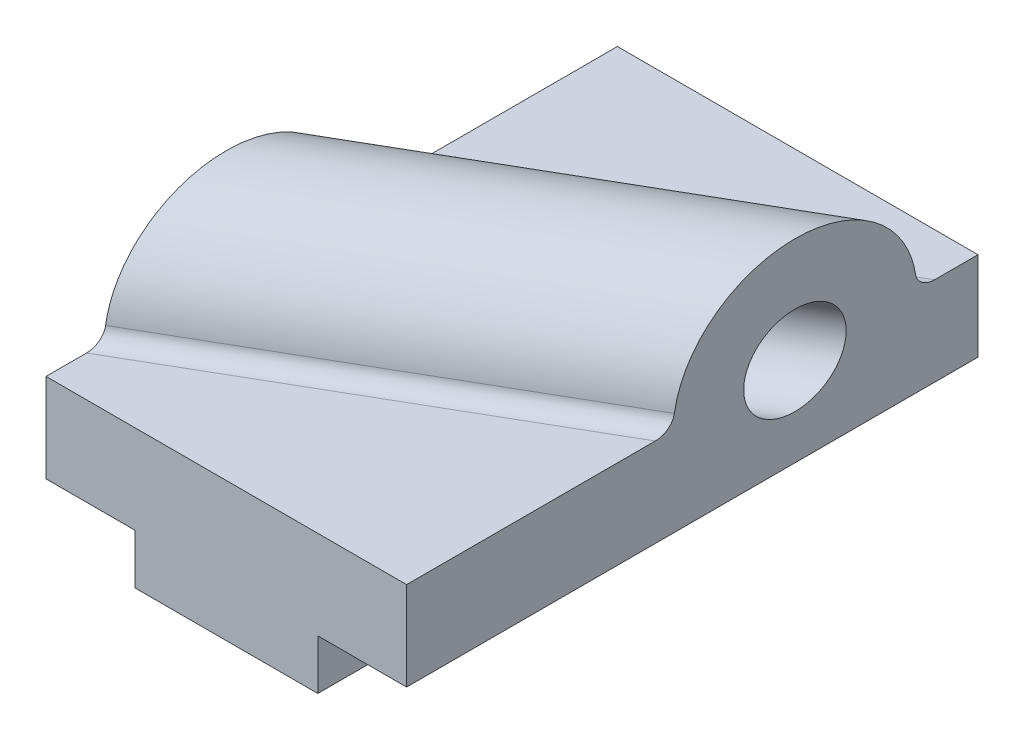
from build123d import *

# Parameters (mm, degrees)
BOSS_EXTRUDE1_DEPTH             = 103
BOSS_EXTRUDE4_REACH             = 109.274
BOSS_EXTRUDE4_DIRECTION_2_REACH = 109.274
CUT_EXTRUDE1_DEPTH              = 111.752171083
CUT_EXTRUDE1_DEPTH_BACK         = 111.752171083
SKETCH4_R                       = 8
FILLET1_R                       = 3


with BuildPart() as part:
    # Sketch2 → Boss-Extrude1 (new body)
    with BuildSketch(Plane.XY):
        Polygon((-14.529411765, -4.382352941), (-14.529411765, -13.382352941), (18.470588235, -13.382352941), (18.470588235, -4.382352941), (34.470588235, -4.382352941), (34.470588235, 11.617647059), (-30.529411765, 11.617647059), (-30.529411765, -4.382352941), align=None)
    extrude(amount=BOSS_EXTRUDE1_DEPTH)

    # Boss-Extrude4: up to this plane
    boss_extrude4_end = Plane(origin=(34.470588235, 11.617647059, 103), z_dir=(-1, 0, 0))
    # Sketch3 → Boss-Extrude4 (add, up to the surface)
    with BuildSketch(Plane(origin=(-18.747367118, 0, 10.823797452), x_dir=(0, 1, 0), z_dir=(0.866025403784438, 0, -0.500000000000001)), mode=Mode.PRIVATE) as boss_extrude4_sk1:
        with BuildLine():
            Line((11.617647059, 64.814132443), (11.617647059, 26.814132443))
            ThreePointArc((11.617647059, 26.814132443), (30.617647059, 45.814132443), (11.617647059, 64.814132443))
        make_face()
    boss_extrude4_tool1 = split(extrude(boss_extrude4_sk1.sketch, amount=BOSS_EXTRUDE4_REACH, mode=Mode.PRIVATE), bisect_by=boss_extrude4_end, keep=Keep.BOTH, mode=Mode.PRIVATE)
    add(boss_extrude4_tool1.solids().sort_by_distance((4.159699, 19.681498, 50.5))[0])

    # Boss-Extrude4 direction 2: up to this plane
    boss_extrude4_direction_2_end = Plane(origin=(-30.529411765, 11.617647059, 103), z_dir=(1, 0, 0))
    # Sketch3 → Boss-Extrude4 direction 2 (add, up to the surface)
    with BuildSketch(Plane(origin=(-18.747367118, 0, 10.823797452), x_dir=(0, 1, 0), z_dir=(0.866025403784438, 0, -0.500000000000001)), mode=Mode.PRIVATE) as boss_extrude4_direction_2_sk1:
        with BuildLine():
            Line((11.617647059, 64.814132443), (11.617647059, 26.814132443))
            ThreePointArc((11.617647059, 26.814132443), (30.617647059, 45.814132443), (11.617647059, 64.814132443))
        make_face()
    boss_extrude4_direction_2_tool1 = split(extrude(boss_extrude4_direction_2_sk1.sketch, amount=-BOSS_EXTRUDE4_DIRECTION_2_REACH, mode=Mode.PRIVATE), bisect_by=boss_extrude4_direction_2_end, keep=Keep.BOTH, mode=Mode.PRIVATE)
    add(boss_extrude4_direction_2_tool1.solids().sort_by_distance((4.159699, 19.681498, 50.5))[0])

    # Sketch4 → Cut-Extrude1 (cut, two sides: drawn at the far end of the back side and taken through both)
    with BuildSketch(Plane(origin=(-18.747367118, 0, 10.823797452), x_dir=(0, 1, 0), z_dir=(0.866025403784438, 0, -0.500000000000001)).offset(-CUT_EXTRUDE1_DEPTH_BACK)):
        with Locations(Location((11.617647059, 45.814132443, 0), (0, 0, 270))):
            Circle(SKETCH4_R)
    extrude(amount=CUT_EXTRUDE1_DEPTH + CUT_EXTRUDE1_DEPTH_BACK, mode=Mode.SUBTRACT)

    # Fillet1
    fillet1_edges = [part.edges().sort_by_distance(p)[0] for p in [
        (1.970588235, 11.617647059, 73.703193978),
        (1.970588235, 11.617647059, 29.824573519),
    ]]
    fillet(fillet1_edges, radius=FILLET1_R)


solid = part.part
